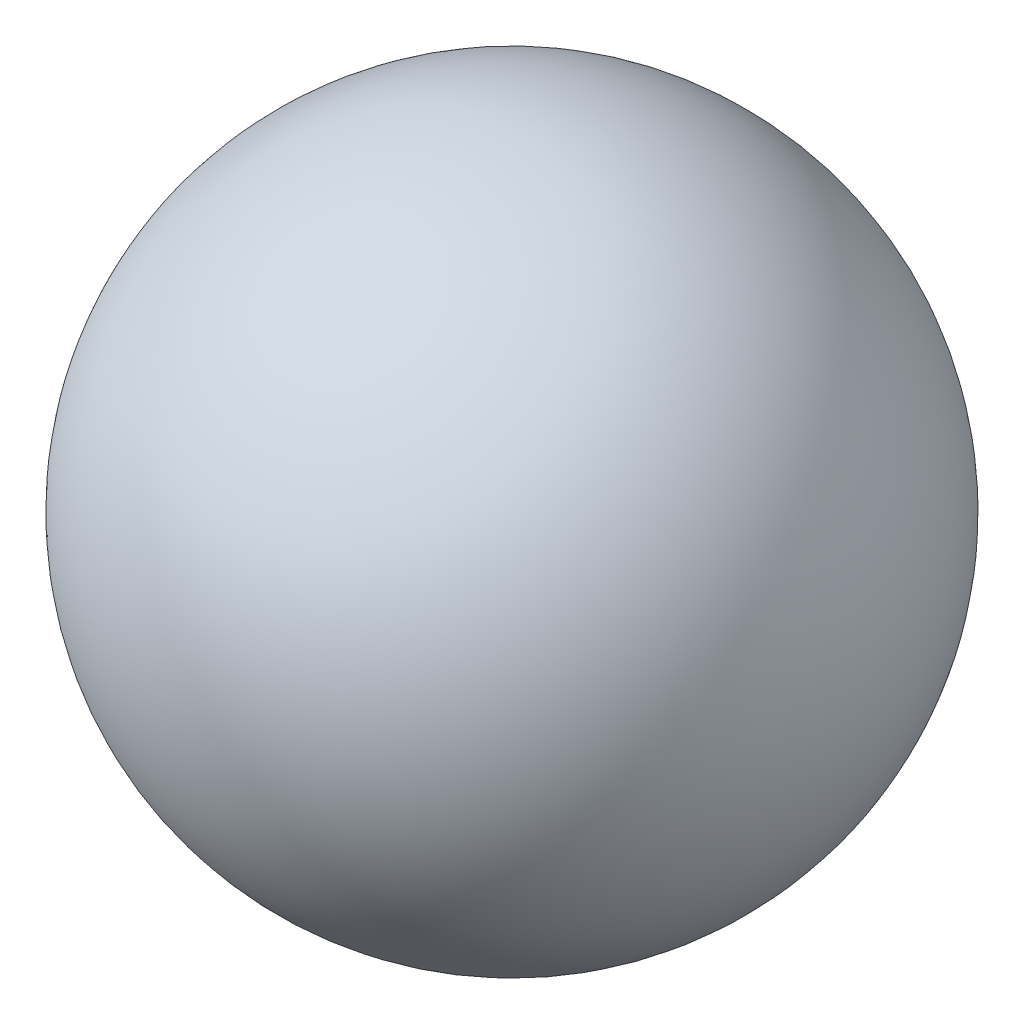
from build123d import *


with BuildPart() as part:
    # Sketch1 → Revolve1 (revolve)
    with BuildSketch(Plane.XY):
        with BuildLine():
            Line((-11.358697233, 0), (12.641302767, 0))
            ThreePointArc((12.641302767, 0), (0.641302767, -12), (-11.358697233, 0))
        make_face()
    revolve(axis=Axis((-11.358697233, 0, 0), (1, 0, 0)))


solid = part.part
